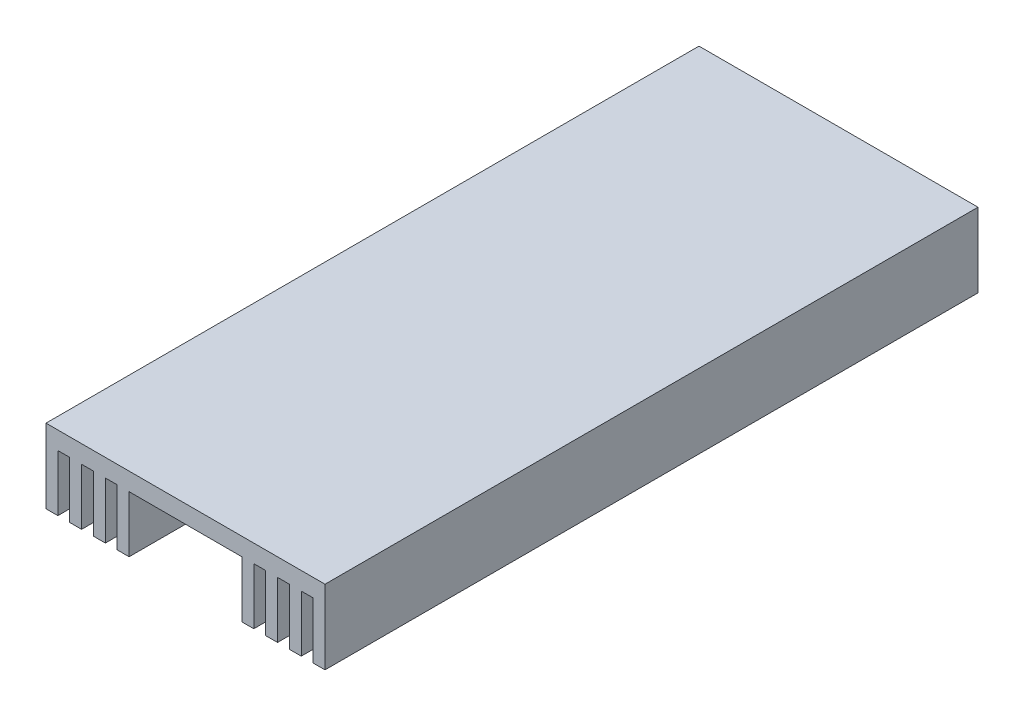
from build123d import *

# Parameters (mm, degrees)
BOSS_EXTRUDE1_DEPTH = 110


with BuildPart() as part:
    # Sketch1 → Boss-Extrude1 (new body)
    with BuildSketch(Plane.XY):
        Polygon((0, 12.5), (0, 0), (2, 0), (2, 9.5), (4, 9.5), (4, 0), (6, 0), (6, 9.5), (8, 9.5), (8, 0), (10, 0), (10, 9.5), (12, 9.5), (12, 0), (14, 0), (14, 9.5), (23.5, 9.5), (23.5, 12.5), align=None)
        Polygon((47, 12.5), (23.5, 12.5), (23.5, 9.5), (33, 9.5), (33, 0), (35, 0), (35, 9.5), (37, 9.5), (37, 0), (39, 0), (39, 9.5), (41, 9.5), (41, 0), (43, 0), (43, 9.5), (45, 9.5), (45, 0), (47, 0), align=None)
    extrude(amount=BOSS_EXTRUDE1_DEPTH)


solid = part.part
